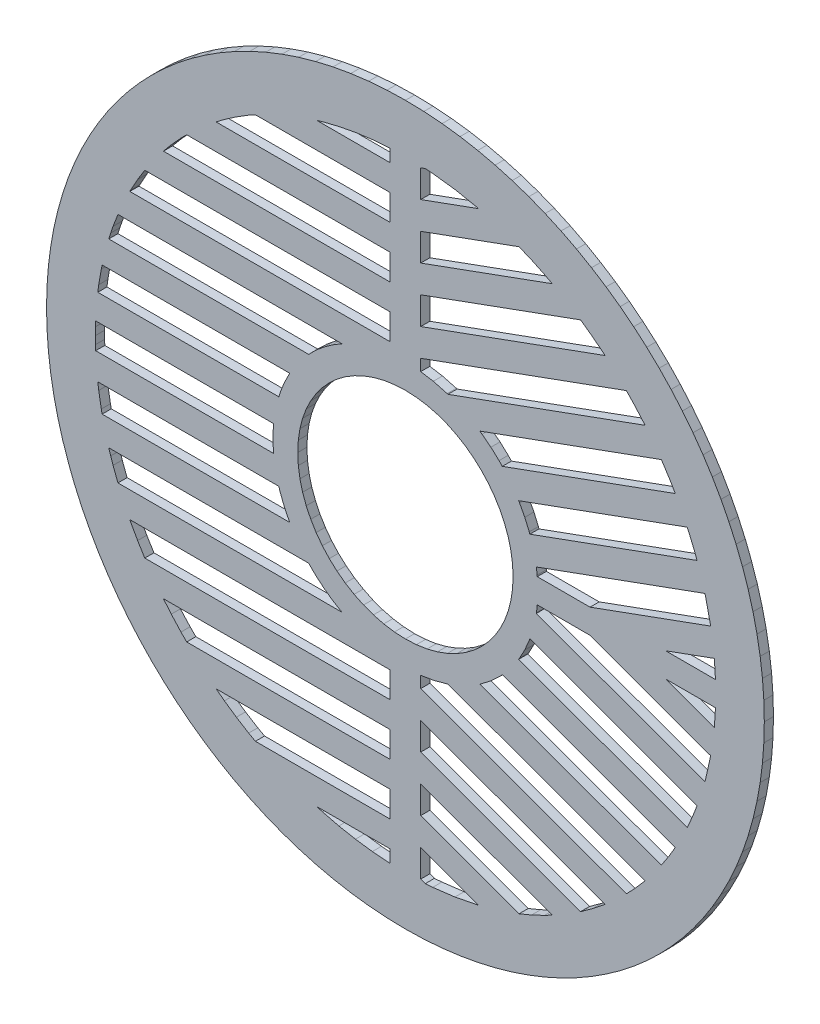
from build123d import *

# Parameters (mm, degrees)
BOSS_EXTRUDE1_DEPTH = 3
SKETCH2_W           = 10
SKETCH2_H           = 79.388055214
BOSS_EXTRUDE2_DEPTH = 3


with BuildPart() as part:
    # Model → Boss-Extrude1 (new body)
    with BuildSketch(Plane.XY):
        Polygon((117.827777778, 188.285105048), (123.879464806, 188.132084532), (129.85169932, 187.677949023), (135.737106662, 186.93008751), (141.528290643, 185.895889106), (147.217865838, 184.582742683), (152.798446825, 182.99803745), (158.262626648, 181.149162361), (163.603041416, 179.043506543), (168.812273407, 176.688458782), (173.88295873, 174.091408539), (178.807701196, 171.259744602), (183.579104614, 168.200855086), (188.189783563, 164.922130797), (192.632363383, 161.43095985), (196.899415588, 157.73473036), (200.983597819, 153.840833134), (204.87750312, 149.756656286), (208.573724535, 145.489590624), (212.064898173, 141.047021569), (215.343617079, 136.436337238), (218.402517361, 131.664933819), (221.234170532, 126.740196737), (223.831234233, 121.669511414), (226.186279975, 116.460274039), (228.291943868, 111.119864655), (230.140818956, 105.655679448), (231.725519816, 100.075103845), (233.038661024, 94.385528649), (234.072857157, 88.594344669), (234.820722792, 82.708937327), (235.274850972, 76.736692047), (235.427877808, 70.685005018), (235.274850972, 64.63331799), (234.820722792, 58.661083476), (234.072857157, 52.775676134), (233.038661024, 46.984492154), (231.725519816, 41.294916958), (230.140818956, 35.714335971), (228.291943868, 30.250156148), (226.186279975, 24.90974138), (223.831234233, 19.700509389), (221.234170532, 14.629824066), (218.402517361, 9.705081601), (215.343617079, 4.933678182), (212.064898173, 0.322999234), (208.573724535, -4.119580587), (204.87750312, -8.386632792), (200.983597819, -12.470815023), (196.899415588, -16.364720323), (192.632363383, -20.060941739), (188.189783563, -23.552115377), (183.579104614, -26.830834283), (178.807701196, -29.889734565), (173.88295873, -32.721387736), (168.812273407, -35.318451436), (163.603041416, -37.673497179), (158.262626648, -39.779161072), (152.798446825, -41.62803616), (147.217865838, -43.21273702), (141.528290643, -44.525878228), (135.737106662, -45.560074361), (129.85169932, -46.307939996), (123.879464806, -46.762068176), (117.827777778, -46.915095011), (111.776090749, -46.762068176), (105.803845469, -46.307939996), (99.918438127, -45.560074361), (94.127254147, -44.525878228), (88.437678952, -43.21273702), (82.857103348, -41.62803616), (77.392918142, -39.779161072), (72.052508757, -37.673497179), (66.843271383, -35.318451436), (61.77258606, -32.721387736), (56.847848977, -29.889734565), (52.076445558, -26.830834283), (47.465761227, -23.552115377), (43.023192173, -20.060941739), (38.75612651, -16.364720323), (34.671949662, -12.470815023), (30.778052436, -8.386632792), (27.081822946, -4.119580587), (23.590652, 0.322999234), (20.311927711, 4.933678182), (17.253038194, 9.705081601), (14.421374257, 14.629824066), (11.824324014, 19.700509389), (9.469276253, 24.90974138), (7.363620435, 30.250156148), (5.514745347, 35.714335971), (3.930040113, 41.294916958), (2.61689369, 46.984492154), (1.582695286, 52.775676134), (0.834833773, 58.661083476), (0.380698264, 64.63331799), (0.227677748, 70.685005018), (0.380698264, 76.736692047), (0.834833773, 82.708937327), (1.582695286, 88.594344669), (2.61689369, 94.385528649), (3.930040113, 100.075103845), (5.514745347, 105.655679448), (7.363620435, 111.119864655), (9.469276253, 116.460274039), (11.824324014, 121.669511414), (14.421374257, 126.740196737), (17.253038194, 131.664933819), (20.311927711, 136.436337238), (23.590652, 141.047021569), (27.081822946, 145.489590624), (30.778052436, 149.756656286), (34.671949662, 153.840833134), (38.75612651, 157.73473036), (43.023192173, 161.43095985), (47.465761227, 164.922130797), (52.076445558, 168.200855086), (56.847848977, 171.259744602), (61.77258606, 174.091408539), (66.843271383, 176.688458782), (72.052508757, 179.043506543), (77.392918142, 181.149162361), (82.857103348, 182.99803745), (88.437678952, 184.582742683), (94.127254147, 185.895889106), (99.918438127, 186.93008751), (105.803845469, 187.677949023), (111.776090749, 188.132084532), align=None)
        Polygon((88.725301361, -26.681661648), (90.692493947, -27.251092868), (96.018030209, -28.568605042), (101.449879964, -29.601918369), (106.979764218, -30.342764621), (112.599447038, -30.78287557), (113.827774302, -30.829556613), (113.827774302, -26.681661648), align=None, mode=Mode.SUBTRACT)
        Polygon((121.827781253, -20.871271261), (121.827781253, -29.881294081), (124.320027924, -30.788409254), (126.767703671, -30.605259366), (134.050118764, -29.707919651), (141.163099755, -28.307897441), (141.816580539, -28.146602376), align=None, mode=Mode.SUBTRACT)
        Polygon((55.782587772, -9.748328315), (58.515910382, -11.814825779), (62.423881361, -14.493559774), (66.460101403, -16.991986084), (68.659671063, -18.214994982), (113.827774302, -18.214994982), (113.827774302, -9.748328315), align=None, mode=Mode.SUBTRACT)
        Polygon((121.827781253, -2.851182556), (121.827781253, -11.861226908), (155.074718306, -23.962124803), (159.161904229, -22.257771471), (163.41164483, -20.248419529), (165.939429813, -18.906511773), align=None, mode=Mode.SUBTRACT)
        Polygon((38.52900859, 7.185005018), (41.103019757, 4.080177307), (44.282662561, 0.587001207), (46.148539734, -1.281661648), (113.827774302, -1.281661648), (113.827774302, 7.185005018), align=None, mode=Mode.SUBTRACT)
        Polygon((121.827781253, 15.168895382), (121.827781253, 6.158840264), (175.227170393, -13.276945835), (175.473139445, -13.115736898), (179.246111128, -10.388276333), (182.886188253, -7.494999017), (183.242540317, -7.184251404), align=None, mode=Mode.SUBTRACT)
        Polygon((27.516933123, 24.118338352), (27.767038981, 23.612124634), (30.073261261, 19.449598779), (32.416273393, 15.651671685), (113.827774302, 15.651671685), (113.827774302, 24.118338352), align=None, mode=Mode.SUBTRACT)
        Polygon((131.746168094, 29.57896542), (131.49236145, 29.488693153), (126.969263289, 28.257997386), (122.264317915, 27.517366452), (121.827781253, 27.48417511), (121.827781253, 24.178928969), (190.236105686, -0.719680447), (192.954156833, 2.124891832), (196.007781813, 5.626594543), (196.354896715, 6.06330346), align=None, mode=Mode.SUBTRACT)
        Polygon((20.620717271, 41.051671685), (21.246103032, 39.059986623), (22.024165736, 36.775231595), (23.620758904, 32.585005018), (97.067373996, 32.585005018), (96.342956543, 32.977099948), (93.838318295, 34.52218221), (91.450124274, 36.228527239), (89.185937542, 38.088534292), (87.053348075, 40.094624159), (86.143606016, 41.051671685), align=None, mode=Mode.SUBTRACT)
        Polygon((149.573116133, 41.110572052), (148.510314941, 40.002467855), (145.828695679, 37.535854848), (142.946657986, 35.298878988), (142.193247901, 34.786582523), (201.689002652, 13.131907315), (204.184694417, 16.940040504), (206.274553935, 20.472932095), align=None, mode=Mode.SUBTRACT)
        Polygon((158.605381351, 55.843167623), (158.400990295, 55.268493398), (156.940549723, 51.872931925), (155.206654697, 48.633939277), (154.92145462, 48.173975966), (210.163722229, 28.067429776), (210.770554267, 29.350867801), (212.586657884, 33.706082153), (213.384951104, 35.905032772), align=None, mode=Mode.SUBTRACT)
        Polygon((17.015571531, 57.985005018), (17.327172343, 55.685640632), (18.166845735, 50.829778544), (18.443227175, 49.518338352), (79.942498737, 49.518338352), (79.06402092, 51.165180122), (77.820352215, 53.855875058), (76.758821403, 56.642106798), (76.334326426, 57.985005018), align=None, mode=Mode.SUBTRACT)
        Polygon((203.082328457, 66.685001543), (219.032345412, 60.879671139), (219.118042162, 61.745068359), (219.427863905, 66.685001543), align=None, mode=Mode.SUBTRACT)
        Polygon((161.028607686, 66.685001543), (160.995416345, 66.248464881), (160.759793345, 64.346492259), (160.715653059, 64.085127936), (215.961817932, 43.977160645), (216.245500014, 45.019538879), (217.808970473, 52.071929253), (217.84835222, 52.300565169), (178.327454885, 66.685001543), align=None, mode=Mode.SUBTRACT)
        Polygon((16.321142557, 74.918338352), (16.258838813, 73.225644514), (16.22769165, 70.685005018), (16.258838813, 68.144365523), (16.321142557, 66.451671685), (74.641600291, 66.451671685), (74.633202871, 66.522220781), (74.485758167, 68.590796068), (74.436105728, 70.685005018), (74.485758167, 72.779213969), (74.633202871, 74.847800022), (74.641600291, 74.918338352), align=None, mode=Mode.SUBTRACT)
        Polygon((219.032345412, 80.490349664), (203.082328457, 74.685008494), (219.427863905, 74.685008494), (219.118042162, 79.624941678), align=None, mode=Mode.SUBTRACT)
        Polygon((18.443227175, 91.851671685), (18.166845735, 90.540231493), (17.327172343, 85.684369405), (17.015571531, 83.385005018), (76.334326426, 83.385005018), (76.758821403, 84.727903239), (77.820352215, 87.514145745), (79.06402092, 90.204840681), (79.942498737, 91.851671685), align=None, mode=Mode.SUBTRACT)
        Polygon((215.961817932, 97.392838626), (160.715663825, 77.2848821), (160.759793345, 77.023528544), (160.995416345, 75.121555922), (161.028607686, 74.685008494), (178.327454885, 74.685008494), (217.84835222, 89.069434102), (217.808970473, 89.298080783), (216.245500014, 96.350460392), align=None, mode=Mode.SUBTRACT)
        Polygon((117.827777778, 105.962788179), (114.220827399, 105.780650287), (110.718069628, 105.246068361), (107.337246704, 104.376768494), (104.096068573, 103.190487544), (101.012288242, 101.704951604), (98.103637187, 99.937897534), (95.387836117, 97.907062191), (92.882616509, 95.630166287), (90.605720605, 93.124946679), (88.574885262, 90.40914561), (86.807831192, 87.500494554), (85.322295252, 84.416714223), (84.136014303, 81.175536092), (83.266714435, 77.794713169), (82.732132509, 74.291955397), (82.549994617, 70.685005018), (82.732132509, 67.07805464), (83.266714435, 63.575307634), (84.136014303, 60.194473945), (85.322295252, 56.95330658), (86.807831192, 53.869526249), (88.574885262, 50.960864427), (90.605720605, 48.245063358), (92.882616509, 45.739854516), (95.387836117, 43.462958611), (98.103637187, 41.432117886), (101.012288242, 39.665063816), (104.096068573, 38.179527876), (107.337246704, 36.993241543), (110.718069628, 36.123947059), (114.220827399, 35.589365133), (117.827777778, 35.407227241), (121.434728156, 35.589365133), (124.937475162, 36.123947059), (128.318308851, 36.993241543), (131.559476217, 38.179527876), (134.643256548, 39.665063816), (137.551918369, 41.432117886), (140.267719438, 43.462958611), (142.77292828, 45.739854516), (145.049824185, 48.245063358), (147.08066491, 50.960864427), (148.847718981, 53.869526249), (150.33325492, 56.95330658), (151.519541253, 60.194473945), (152.388835737, 63.575307634), (152.923417664, 67.07805464), (153.105555556, 70.685005018), (152.923417664, 74.291955397), (152.388835737, 77.794713169), (151.519541253, 81.175536092), (150.33325492, 84.416714223), (148.847718981, 87.500494554), (147.08066491, 90.40914561), (145.049824185, 93.124946679), (142.77292828, 95.630166287), (140.267719438, 97.907062191), (137.551918369, 99.937897534), (134.643256548, 101.704951604), (131.559476217, 103.190487544), (128.318308851, 104.376768494), (124.937475162, 105.246068361), (121.434728156, 105.780650287), align=None, mode=Mode.SUBTRACT)
        Polygon((23.620761596, 108.785010401), (22.024165736, 104.594773059), (21.246103032, 102.310023414), (20.620721308, 100.318343735), (86.143606016, 100.318343735), (87.053348075, 101.275396644), (89.185937542, 103.281486511), (91.450124274, 105.141493564), (93.838318295, 106.84783321), (96.342956543, 108.392920854), (97.067373996, 108.785010401), align=None, mode=Mode.SUBTRACT)
        Polygon((210.163722229, 113.302574878), (154.921465386, 93.196034071), (155.206654697, 92.736081526), (156.940549723, 89.497088877), (158.400990295, 86.101527405), (158.605381351, 85.526842414), (213.384951104, 105.464977264), (212.586657884, 107.663927884), (210.770554267, 112.01913147), align=None, mode=Mode.SUBTRACT)
        Polygon((32.416278776, 125.718343735), (30.073261261, 121.920411258), (27.767038981, 117.757885403), (27.516935815, 117.251677068), (113.827774302, 117.251677068), (113.827774302, 125.718343735), align=None, mode=Mode.SUBTRACT)
        Polygon((201.68898112, 128.238108105), (142.193247901, 106.583427514), (142.946657986, 106.071141815), (145.828695679, 103.834160572), (148.510314941, 101.367547565), (149.573116133, 100.259443368), (206.274553935, 120.897077942), (204.184694417, 124.42996415), align=None, mode=Mode.SUBTRACT)
        Polygon((190.236105686, 142.089685101), (121.827781253, 117.191086451), (121.827781253, 113.885845693), (122.264317915, 113.852648968), (126.969263289, 113.112023417), (131.49236145, 111.88132765), (131.746189626, 111.79105), (196.354896715, 135.306701194), (196.007781813, 135.743415493), (192.954156833, 139.245107439), align=None, mode=Mode.SUBTRACT)
        Polygon((46.148545117, 142.651677068), (44.282662561, 140.783014213), (41.103019757, 137.289838113), (38.529016664, 134.185010401), (113.827774302, 134.185010401), (113.827774302, 142.651677068), align=None, mode=Mode.SUBTRACT)
        Polygon((175.227170393, 154.646950489), (121.827781253, 135.21116439), (121.827781253, 126.20112542), (183.242518785, 148.554264132), (182.886188253, 148.865000979), (179.246111128, 151.75828637), (175.473139445, 154.485755009), align=None, mode=Mode.SUBTRACT)
        Polygon((68.659671063, 159.58500771), (66.460101403, 158.361990738), (62.423881361, 155.863567119), (58.515910382, 153.184838507), (55.782587772, 151.118341043), (113.827774302, 151.118341043), (113.827774302, 159.58500771), align=None, mode=Mode.SUBTRACT)
        Polygon((155.07470754, 165.332132149), (121.827781253, 153.231234254), (121.827781253, 144.22120605), (165.939419047, 160.276527193), (163.41164483, 161.618424182), (159.161904229, 163.627776125), align=None, mode=Mode.SUBTRACT)
        Polygon((124.320027924, 172.158415254), (121.827781253, 171.251313538), (121.827781253, 162.241275915), (141.816591305, 169.51660703), (141.163099755, 169.677916898), (134.050118764, 171.07793507), (126.767703671, 171.975277477), align=None, mode=Mode.SUBTRACT)
        Polygon((113.827774302, 172.199561267), (112.599447038, 172.152888298), (106.979764218, 171.712771967), (101.449879964, 170.971925714), (96.018030209, 169.938615078), (90.692493947, 168.621102905), (88.725295978, 168.051674377), (113.827774302, 168.051674377), align=None, mode=Mode.SUBTRACT)
    extrude(amount=BOSS_EXTRUDE1_DEPTH)

    # Sketch2 → Boss-Extrude2 (add)
    with BuildSketch(Plane.XY.offset(3)):
        with Locations((117.827777778, -4.286805749)):
            Rectangle(SKETCH2_W, SKETCH2_H)
        with Locations((117.827777778, 145.656815786)):
            Rectangle(SKETCH2_W, SKETCH2_H)
    extrude(amount=-BOSS_EXTRUDE2_DEPTH)


solid = part.part
